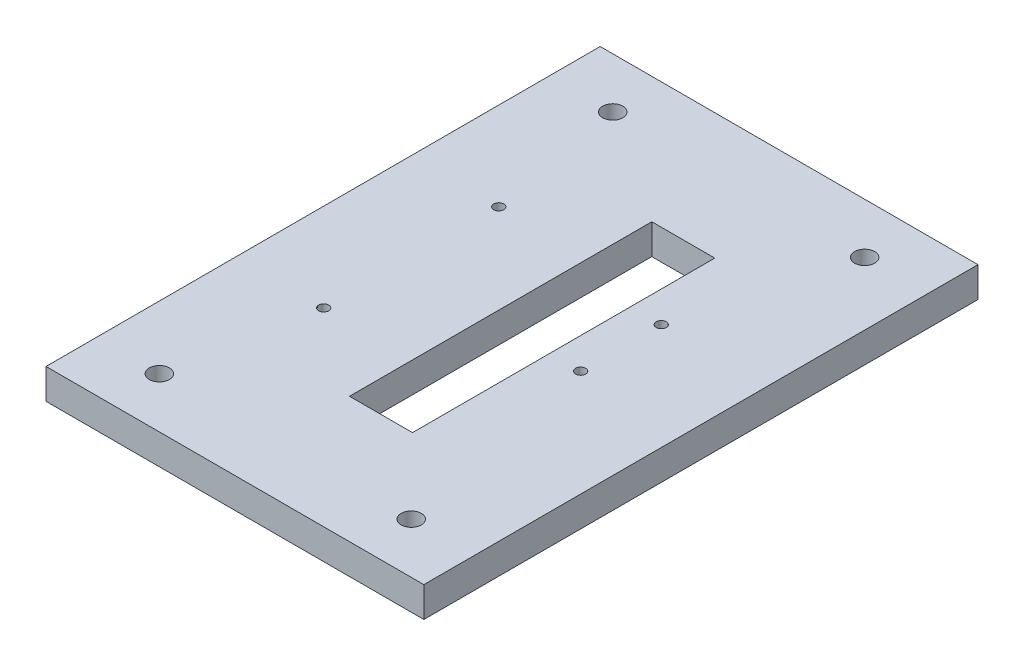
from build123d import *

# Parameters (mm, degrees)
SKETCH1_W           = 150
SKETCH1_H           = 220
SKETCH1_R           = 2
SKETCH1_R_2         = 4
SKETCH1_W_2         = 25
SKETCH1_H_2         = 120
BOSS_EXTRUDE1_DEPTH = 12
SKETCH2_R           = 2
CUT_EXTRUDE1_DEPTH  = 12


with BuildPart() as part:
    # Sketch1 → Boss-Extrude1 (new body)
    with BuildSketch(Plane(origin=(0, 0, 0), x_dir=(1, 0, 0), z_dir=(0, 1, 0))):
        Rectangle(SKETCH1_W, SKETCH1_H)
        with Locations(Location((-40, 34.75, 0), (0, 0, 270))):
            Circle(SKETCH1_R, mode=Mode.SUBTRACT)
        with Locations(Location((-40, -34.75, 0), (0, 0, 270))):
            Circle(SKETCH1_R, mode=Mode.SUBTRACT)
        with Locations(Location((-50, 90, 0), (0, 0, 270))):
            Circle(SKETCH1_R_2, mode=Mode.SUBTRACT)
        with Locations(Location((50, 90, 0), (0, 0, 270))):
            Circle(SKETCH1_R_2, mode=Mode.SUBTRACT)
        with Locations(Location((-50, -90, 0), (0, 0, 270))):
            Circle(SKETCH1_R_2, mode=Mode.SUBTRACT)
        with Locations(Location((50, -90, 0), (0, 0, 270))):
            Circle(SKETCH1_R_2, mode=Mode.SUBTRACT)
        with Locations((8, 0)):
            Rectangle(SKETCH1_W_2, SKETCH1_H_2, mode=Mode.SUBTRACT)
    extrude(amount=BOSS_EXTRUDE1_DEPTH)

    # Sketch2 → Cut-Extrude1 (cut)
    with BuildSketch(Plane(origin=(0, 12, 0), x_dir=(1, 0, 0), z_dir=(0, 1, 0))):
        with Locations(Location((32.75, 26.5, 0), (0, 0, 270))):
            Circle(SKETCH2_R)
        with Locations(Location((32.75, -5.5, 0), (0, 0, 270))):
            Circle(SKETCH2_R)
    extrude(amount=-CUT_EXTRUDE1_DEPTH, mode=Mode.SUBTRACT)


solid = part.part
